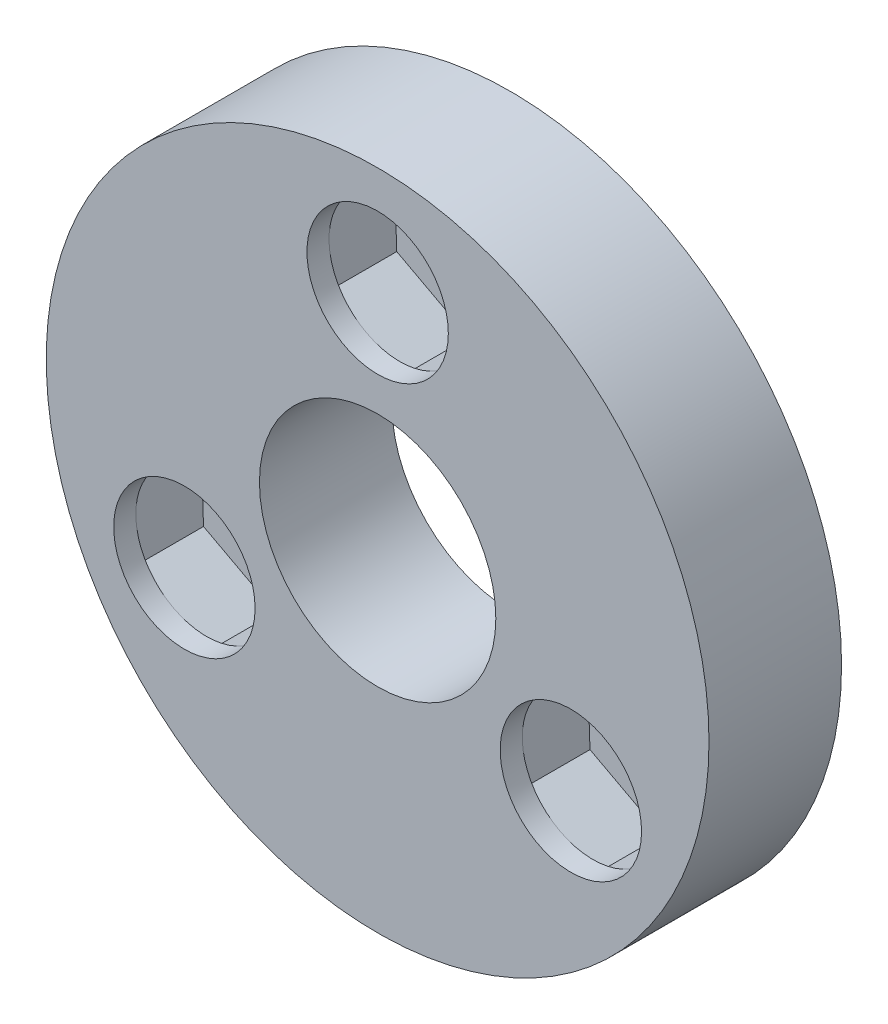
from build123d import *

# Parameters (mm, degrees)
SKETCH1_R           = 15
BOSS_EXTRUDE1_DEPTH = 6
SKETCH5_R           = 5.35
CUT_EXTRUDE2_DEPTH  = 11.5
CUT_EXTRUDE3_START  = -1
CUT_EXTRUDE3_DEPTH  = 3
SKETCH7_R           = 3.2
CUT_EXTRUDE4_DEPTH  = 2.5


with BuildPart() as part:
    # Sketch1 → Boss-Extrude1 (new body)
    with BuildSketch(Plane(origin=(0, 0, 0), x_dir=(0, 1, 0), z_dir=(0, 0, 1))):
        with Locations(Location((0, 0, 0), (0, 0, 270))):
            Circle(SKETCH1_R)
    extrude(amount=BOSS_EXTRUDE1_DEPTH)

    # Sketch5 → Cut-Extrude2 (cut)
    with BuildSketch(Plane(origin=(0, 0, 0), x_dir=(1, 0, 0), z_dir=(0, 0, -1))):
        with Locations(Location((0, 0, 0), (0, 0, 180))):
            Circle(SKETCH5_R)
    extrude(amount=-CUT_EXTRUDE2_DEPTH, mode=Mode.SUBTRACT)

    # Sketch2 → Cut-Extrude3 (cut)
    with BuildSketch(Plane.XY.offset(6).offset(CUT_EXTRUDE3_START)):
        Polygon((8.873853267, -8.742858672), (12.008464346, -6.786446977), (11.881467657, -3.093588305), (8.619859889, -1.357141328), (5.485248811, -3.313553023), (5.6122455, -7.006411695), align=None)
        Polygon((3.134611078, 12.056411695), (-0.126996689, 13.792858672), (-3.261607767, 11.836446977), (-3.134611078, 8.143588305), (0.126996689, 6.407141328), (3.261607767, 8.363553023), align=None)
        Polygon((-12.008464346, -3.313553023), (-11.881467657, -7.006411695), (-8.619859889, -8.742858672), (-5.485248811, -6.786446977), (-5.6122455, -3.093588305), (-8.873853267, -1.357141328), align=None)
    extrude(amount=-CUT_EXTRUDE3_DEPTH, mode=Mode.SUBTRACT)

    # Sketch7 → Cut-Extrude4 (cut)
    with BuildSketch(Plane.XY.offset(6)):
        with Locations((8.746856578, -5.05)):
            Circle(SKETCH7_R)
        with Locations((0, 10.1)):
            Circle(SKETCH7_R)
        with Locations((-8.746856578, -5.05)):
            Circle(SKETCH7_R)
    extrude(amount=-CUT_EXTRUDE4_DEPTH, mode=Mode.SUBTRACT)


solid = part.part
